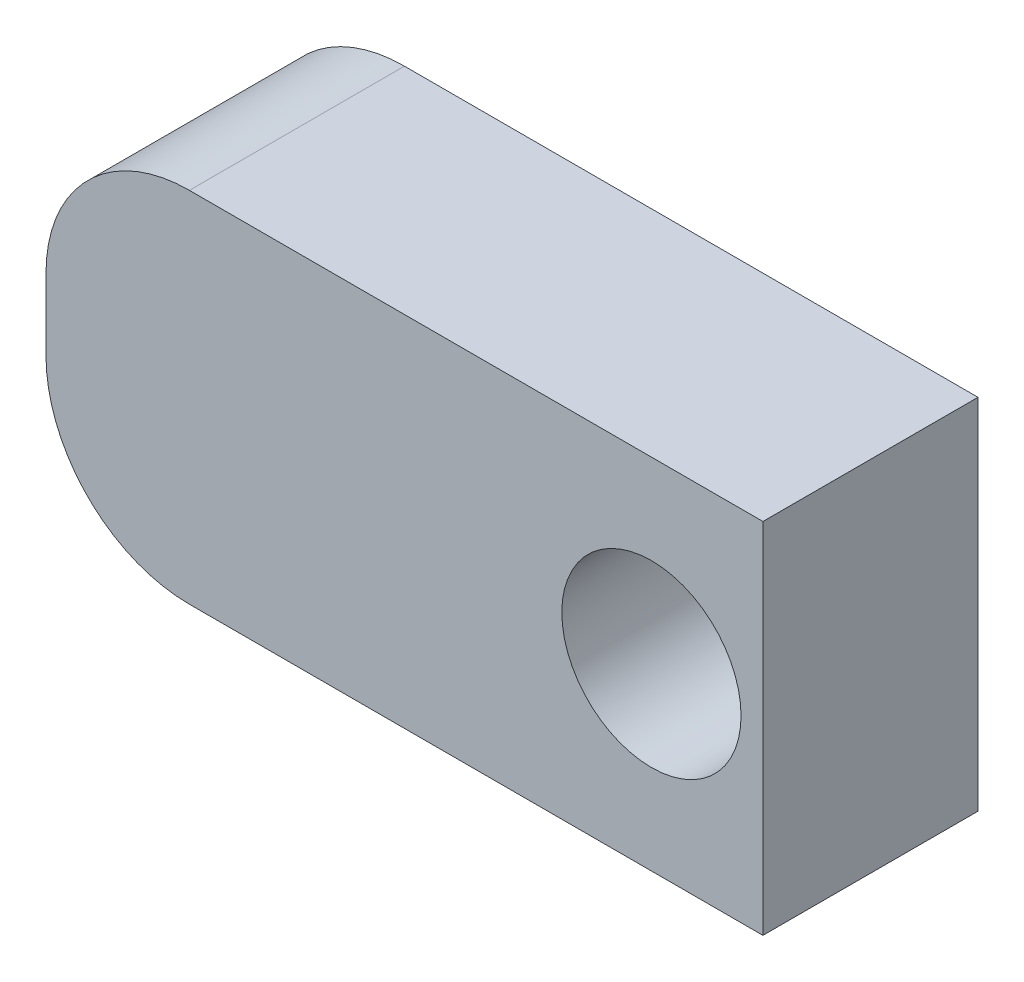
from build123d import *

# Parameters (mm, degrees)
SKETCH1_R           = 2.5
BOSS_EXTRUDE1_DEPTH = 6


with BuildPart() as part:
    # Sketch1 → Boss-Extrude1 (new body)
    with BuildSketch(Plane.XY):
        with BuildLine():
            Line((-6, 5), (10, 5))
            Line((10, 5), (10, -5))
            Line((10, -5), (-6, -5))
            ThreePointArc((-6, -5), (-8.828427125, -3.828427125), (-10, -1))
            Line((-10, -1), (-10, 1))
            ThreePointArc((-10, 1), (-8.828427125, 3.828427125), (-6, 5))
        make_face()
        with Locations((6.889669794, 0)):
            Circle(SKETCH1_R, mode=Mode.SUBTRACT)
    extrude(amount=BOSS_EXTRUDE1_DEPTH)


solid = part.part
